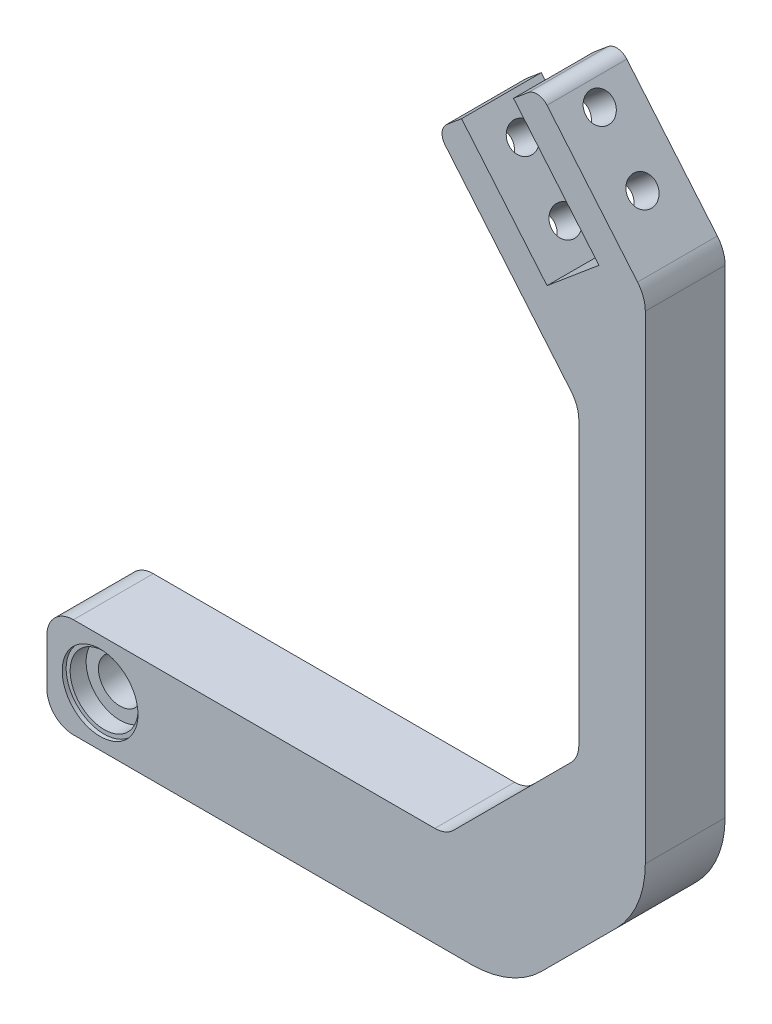
from build123d import *

# Parameters (mm, degrees)
EXTRUDE_1_DEPTH     = 6
CUT_EXTRUDE_1_DEPTH = 122.974454449
SKETCH_3_R          = 3.25
CUT_EXTRUDE_2_DEPTH = 122.974454449
SKETCH_4_R          = 2.1
CUT_EXTRUDE_3_DEPTH = 141.351978867
CHAMFER_1_SIZE      = 20
CHAMFER_2_SIZE      = 20
FILLET_1_R          = 4
FILLET_2_R          = 2
FILLET_3_R          = 15
SKETCH_5_R          = 5.1
CUT_EXTRUDE_4_DEPTH = 3
SKETCH_7_R          = 5.7
CUT_EXTRUDE_6_DEPTH = 0.6
CUT_EXTRUDE_START   = -3
SKETCH_8_R          = 5.1
CUT_EXTRUDE_7_DEPTH = 3
CUT_EXTRUDE_START_2 = -0.6
SKETCH_9_R          = 5.7
CUT_EXTRUDE_8_DEPTH = 0.6
CUT_EXTRUDE_START_3 = -4
SKETCH_6_R          = 5.1
CUT_EXTRUDE_5_DEPTH = 4
FILLET_4_R          = 5


with BuildPart() as part:
    # 草图1 → 凸台-拉伸1 (new, symmetric)
    with BuildSketch(Plane.XY):
        Polygon((0, 0), (15.320888862, 12.855752194), (31.390579105, -6.295358884), (31.390579105, -106.295358884), (-58.609420895, -106.295358884), (-58.609420895, -91.295358884), (21.390579105, -91.295358884), (21.390579105, -25.492299496), align=None)
    extrude(amount=EXTRUDE_1_DEPTH, both=True)

    # 草图2 → 切除-拉伸1 (cut, through all)
    with BuildSketch(Plane.XY.offset(6)):
        Polygon((3.753617771, 3.149659287), (16.609369965, -12.171229575), (24.423023285, -5.614795956), (11.567271091, 9.706092906), align=None)
    extrude(amount=-CUT_EXTRUDE_1_DEPTH, mode=Mode.SUBTRACT)

    # 草图3 → 切除-拉伸2 (cut, through all)
    with BuildSketch(Plane.XY.offset(6)):
        with Locations((-50.609420895, -98.795358884)):
            Circle(SKETCH_3_R)
    extrude(amount=-CUT_EXTRUDE_2_DEPTH, mode=Mode.SUBTRACT)

    # 草图4 → 切除-拉伸3 (cut, through all)
    with BuildSketch(Plane(origin=(15.320888862, 12.855752194, 0), x_dir=(0, 0, -1), z_dir=(0.766044443118977, 0.6427876096865407, 0))):
        with Locations(Location((0, -5, 0), (0, 0, 90))):
            Circle(SKETCH_4_R)
        with Locations(Location((0, -15, 0), (0, 0, 90))):
            Circle(SKETCH_4_R)
    extrude(amount=-CUT_EXTRUDE_3_DEPTH, mode=Mode.SUBTRACT)

    # 倒角1
    chamfer_1_edges = [part.edges().sort_by_distance(p)[0] for p in [
        (21.390579105, -91.295358884, 0),
    ]]
    chamfer(chamfer_1_edges, length=CHAMFER_1_SIZE)

    # 倒角2
    chamfer_2_edges = [part.edges().sort_by_distance(p)[0] for p in [
        (31.390579105, -106.295358884, 0),
    ]]
    chamfer(chamfer_2_edges, length=CHAMFER_2_SIZE)

    # 圆角1
    fillet_1_edges = [part.edges().sort_by_distance(p)[0] for p in [
        (-58.609420895, -106.295358884, 0),
        (-58.609420895, -91.295358884, 0),
        (1.390579105, -91.295358884, 0),
        (21.390579105, -71.295358884, 0),
    ]]
    fillet(fillet_1_edges, radius=FILLET_1_R)

    # 圆角2
    fillet_2_edges = [part.edges().sort_by_distance(p)[0] for p in [
        (0, 0, 0),
        (15.320888862, 12.855752194, 0),
    ]]
    fillet(fillet_2_edges, radius=FILLET_2_R)

    # 圆角3
    fillet_3_edges = [part.edges().sort_by_distance(p)[0] for p in [
        (31.390579105, -86.295358884, 0),
        (11.390579105, -106.295358884, 0),
    ]]
    fillet(fillet_3_edges, radius=FILLET_3_R)

    # 草图5 → 切除-拉伸4 (cut)
    with BuildSketch(Plane.XY.offset(6)):
        with Locations((-50.609420895, -98.795358884)):
            Circle(SKETCH_5_R)
    extrude(amount=-CUT_EXTRUDE_4_DEPTH, mode=Mode.SUBTRACT)

    # 草图7 → 切除-拉伸6 (cut)
    with BuildSketch(Plane.XY.offset(6)):
        with Locations((-50.609420895, -98.795358884)):
            Circle(SKETCH_7_R)
    extrude(amount=-CUT_EXTRUDE_6_DEPTH, mode=Mode.SUBTRACT)

    # 草图8 → 切除-拉伸7 (cut)
    with BuildSketch(Plane(origin=(0, 0, -6), x_dir=(-1, 0, 0), z_dir=(0, 0, -1)).offset(CUT_EXTRUDE_START)):
        with Locations(Location((50.609420895, -98.795358884, 0), (0, 0, 180))):
            Circle(SKETCH_8_R)
    extrude(amount=CUT_EXTRUDE_7_DEPTH, mode=Mode.SUBTRACT)

    # 草图9 → 切除-拉伸8 (cut)
    with BuildSketch(Plane(origin=(0, 0, -6), x_dir=(-1, 0, 0), z_dir=(0, 0, -1)).offset(CUT_EXTRUDE_START_2)):
        with Locations(Location((50.609420895, -98.795358884, 0), (0, 0, 180))):
            Circle(SKETCH_9_R)
    extrude(amount=CUT_EXTRUDE_8_DEPTH, mode=Mode.SUBTRACT)

    # 草图6 → 切除-拉伸5 (cut)
    with BuildSketch(Plane(origin=(0, 0, -6), x_dir=(-1, 0, 0), z_dir=(0, 0, -1)).offset(CUT_EXTRUDE_START_3)):
        with Locations((50.609420895, -98.795358884)):
            Circle(SKETCH_6_R)
    extrude(amount=CUT_EXTRUDE_5_DEPTH, mode=Mode.SUBTRACT)

    # 圆角4
    fillet_4_edges = [part.edges().sort_by_distance(p)[0] for p in [
        (31.390579105, -6.295358884, 0),
        (21.390579105, -25.492299496, 0),
    ]]
    fillet(fillet_4_edges, radius=FILLET_4_R)


solid = part.part
